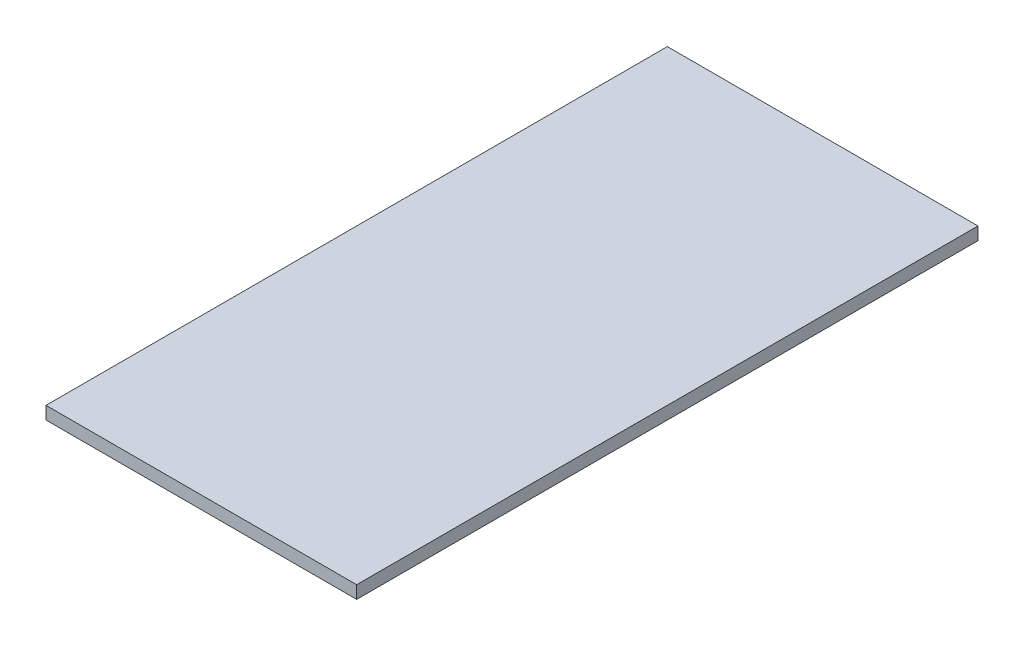
from build123d import *

# Parameters (mm, degrees)
SKETCH1_W           = 2438.4
SKETCH1_H           = 4876.8
BOSS_EXTRUDE1_DEPTH = 100


with BuildPart() as part:
    # Sketch1 → Boss-Extrude1 (new body)
    with BuildSketch(Plane(origin=(0, 0, 0), x_dir=(1, 0, 0), z_dir=(0, 1, 0))):
        Rectangle(SKETCH1_W, SKETCH1_H)
    extrude(amount=BOSS_EXTRUDE1_DEPTH)


solid = part.part
